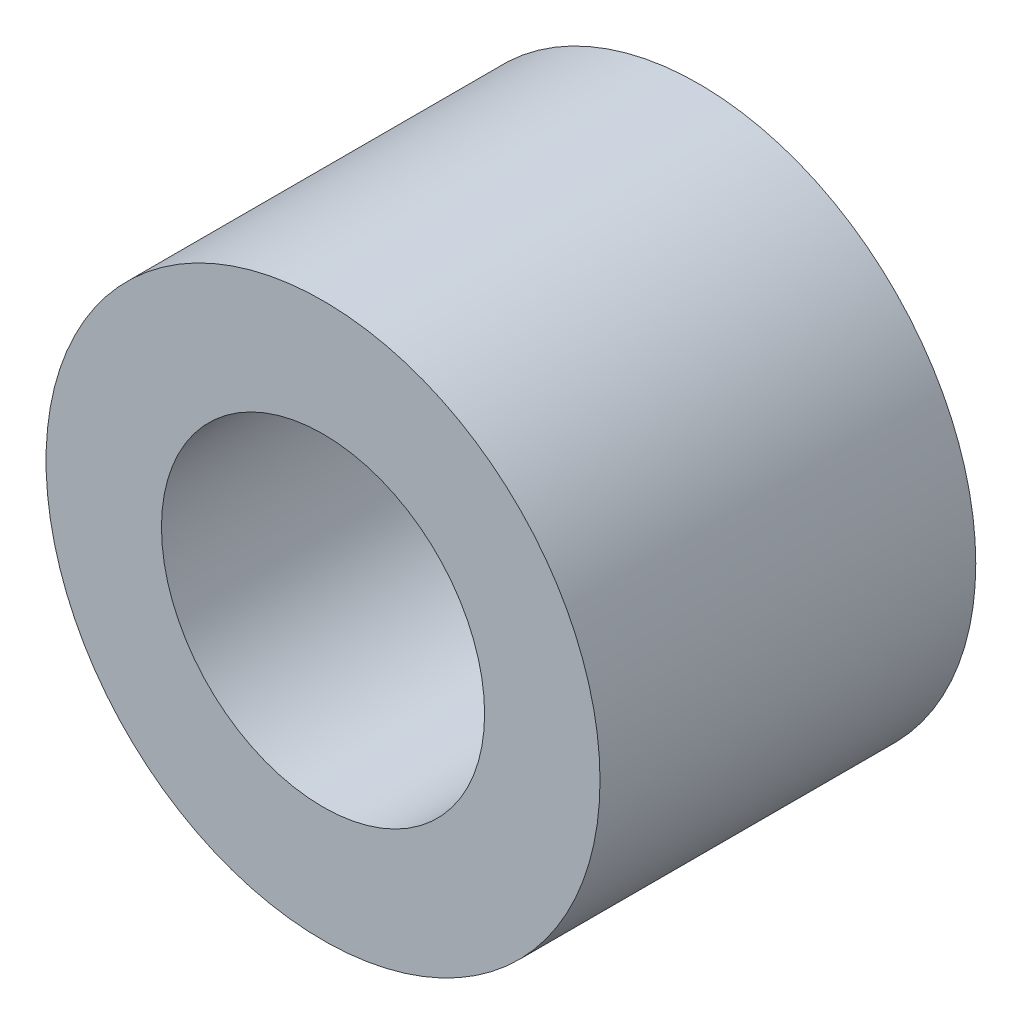
from build123d import *

# Parameters (mm, degrees)
SKETCH1_R           = 30.48
SKETCH1_R_2         = 17.78
BOSS_EXTRUDE1_DEPTH = 41.35000112


with BuildPart() as part:
    # Sketch1 → Boss-Extrude1 (new body)
    with BuildSketch(Plane.XY):
        Circle(SKETCH1_R)
        Circle(SKETCH1_R_2, mode=Mode.SUBTRACT)
    extrude(amount=BOSS_EXTRUDE1_DEPTH)


solid = part.part
